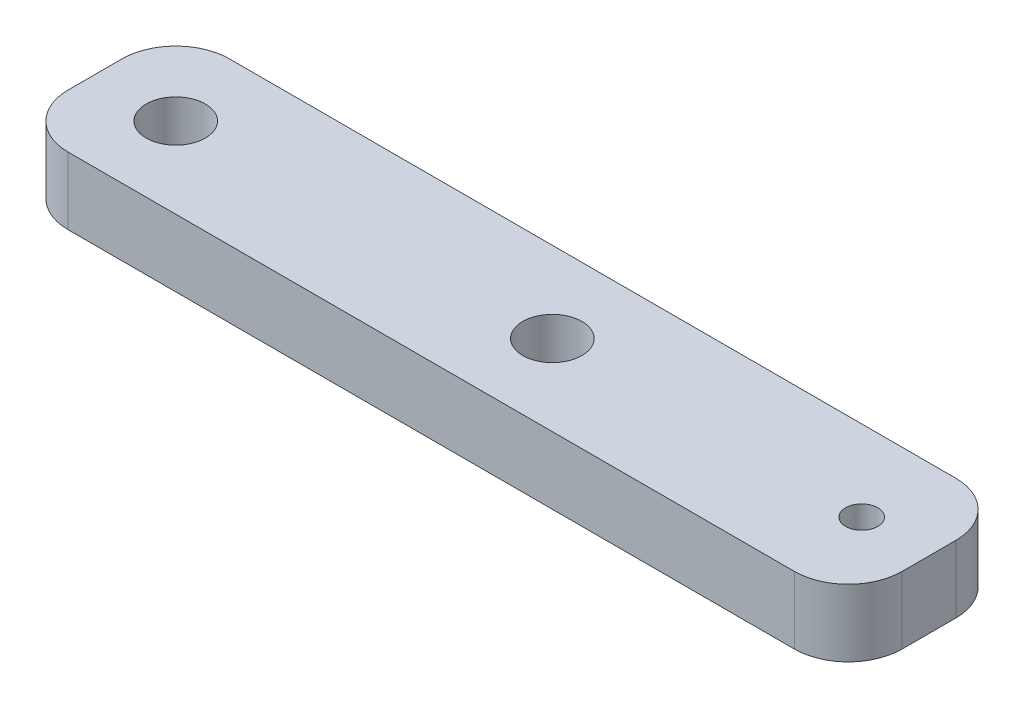
from build123d import *

# Parameters (mm, degrees)
SKETCH_1_W          = 31
SKETCH_1_H          = 6
EXTRUDE_1_DEPTH     = 2.5
SKETCH_2_R          = 1.1
CUT_EXTRUDE_1_DEPTH = 32.608171111
SKETCH_3_R          = 0.6
CUT_EXTRUDE_2_DEPTH = 32.608171111
FILLET_1_R          = 2


with BuildPart() as part:
    # 草图1 → 凸台-拉伸1 (new body)
    with BuildSketch(Plane(origin=(0, 0, 0), x_dir=(1, 0, 0), z_dir=(0, 1, 0))):
        with Locations((15.5, -2.64149634)):
            Rectangle(SKETCH_1_W, SKETCH_1_H)
    extrude(amount=EXTRUDE_1_DEPTH)

    # 草图2 → 切除-拉伸1 (cut, through all)
    with BuildSketch(Plane(origin=(0, 2.5, 0), x_dir=(1, 0, 0), z_dir=(0, 1, 0))):
        with Locations(Location((3, -2.64149634, 0), (0, 0, 270))):
            Circle(SKETCH_2_R)
        with Locations(Location((17, -2.64149634, 0), (0, 0, 270))):
            Circle(SKETCH_2_R)
    extrude(amount=-CUT_EXTRUDE_1_DEPTH, mode=Mode.SUBTRACT)

    # 草图3 → 切除-拉伸2 (cut, through all)
    with BuildSketch(Plane(origin=(0, 2.5, 0), x_dir=(1, 0, 0), z_dir=(0, 1, 0))):
        with Locations(Location((28.5, -2.64149634, 0), (0, 0, 270))):
            Circle(SKETCH_3_R)
    extrude(amount=-CUT_EXTRUDE_2_DEPTH, mode=Mode.SUBTRACT)

    # 圆角1
    fillet_1_edges = [part.edges().sort_by_distance(p)[0] for p in [
        (0, 1.25, -0.35850366),
        (31, 1.25, -0.35850366),
        (31, 1.25, 5.64149634),
        (0, 1.25, 5.64149634),
    ]]
    fillet(fillet_1_edges, radius=FILLET_1_R)


solid = part.part
